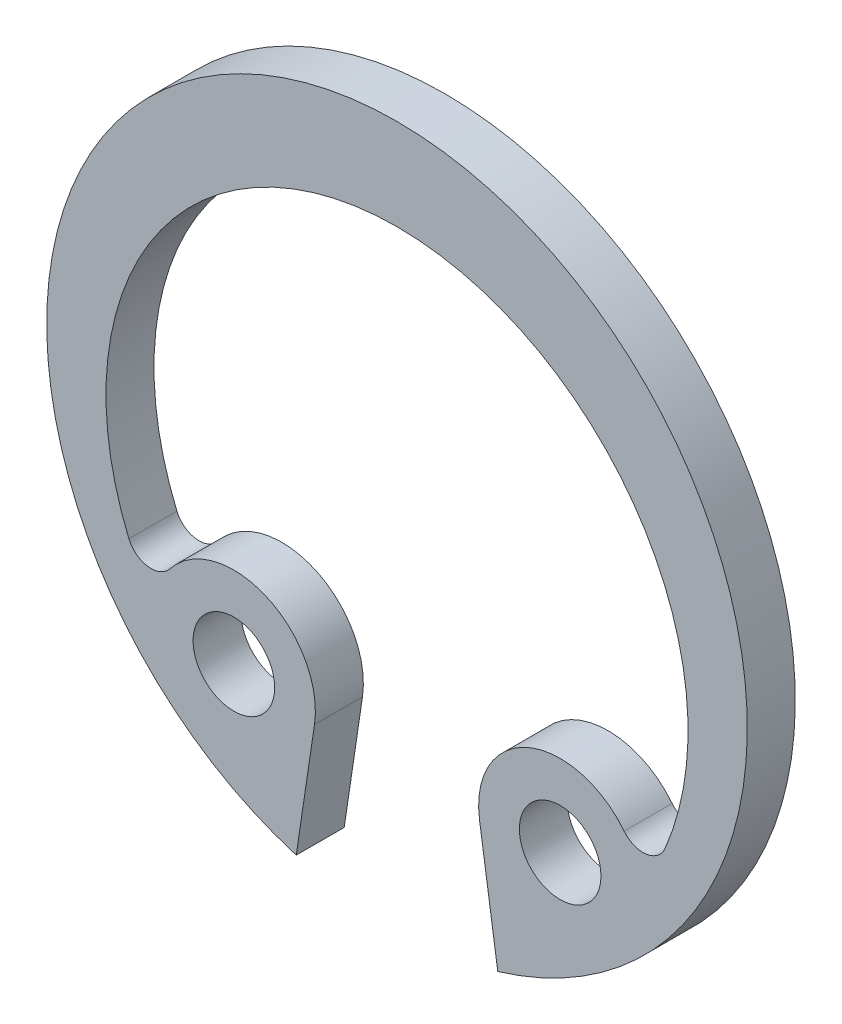
from build123d import *

# Parameters (mm, degrees)
SKETCH1_R           = 0.85
BOSS_EXTRUDE1_DEPTH = 1


with BuildPart() as part:
    # Sketch1 → Boss-Extrude1 (new body)
    with BuildSketch(Plane.XY):
        with BuildLine():
            Line((-1.719484415, -4.445334087), (-2.1, -6.991423317))
            ThreePointArc((-2.1, -6.991423317), (0, 7.3), (2.1, -6.991423317))
            Line((2.1, -6.991423317), (1.719484415, -4.445334087))
            ThreePointArc((1.719484415, -4.445334087), (2.7252628, -2.634711157), (4.733595386, -3.14121464))
            ThreePointArc((4.733595386, -3.14121464), (5.192940459, -3.326870849), (5.586577433, -3.026011983))
            ThreePointArc((5.586577433, -3.026011983), (0, 5.4), (-5.586577433, -3.026011983))
            ThreePointArc((-5.586577433, -3.026011983), (-5.192940459, -3.326870849), (-4.733595386, -3.14121464))
            ThreePointArc((-4.733595386, -3.14121464), (-2.7252628, -2.634711157), (-1.719484415, -4.445334087))
        make_face()
        with Locations((-3.4, -4.19417935)):
            Circle(SKETCH1_R, mode=Mode.SUBTRACT)
        with Locations((3.4, -4.19417935)):
            Circle(SKETCH1_R, mode=Mode.SUBTRACT)
    extrude(amount=BOSS_EXTRUDE1_DEPTH)


solid = part.part
